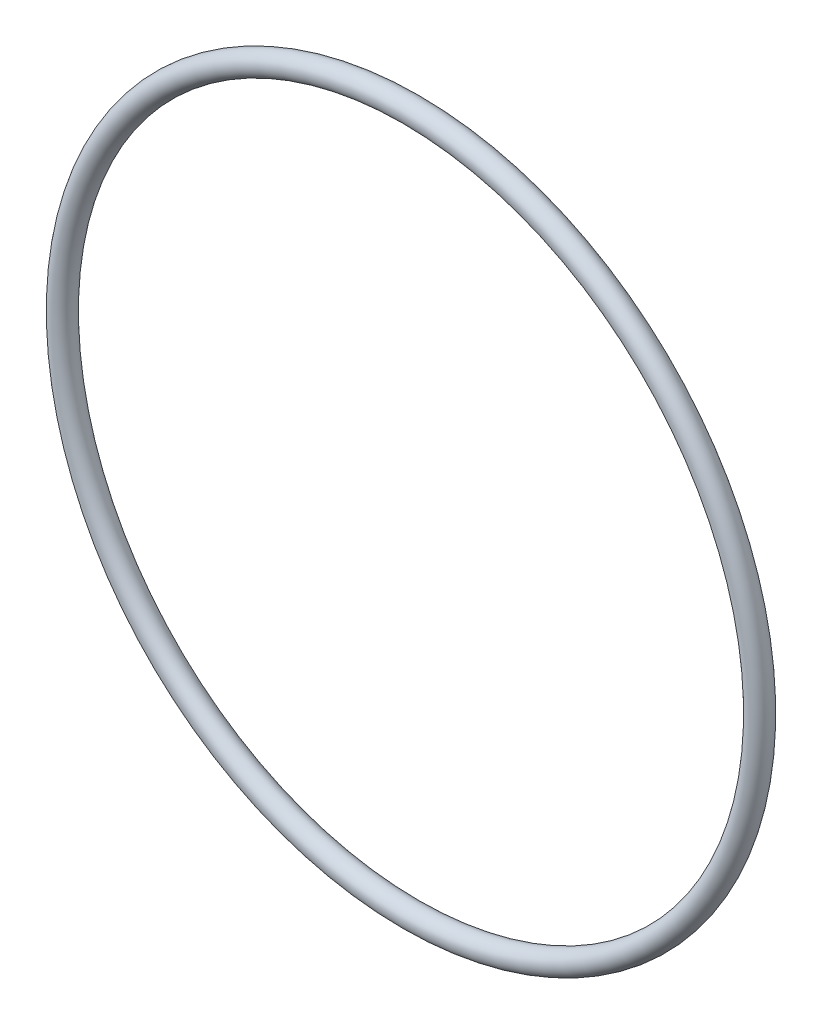
from build123d import *

# Parameters (mm, degrees)
SKETCH1_R = 0.75


with BuildPart() as part:
    # Sketch1 → Revolve1 (revolve)
    with BuildSketch(Plane(origin=(0, 0, 0), x_dir=(0, 0, -1), z_dir=(1, 0, 0))):
        with Locations((0, 23)):
            Circle(SKETCH1_R)
    revolve(axis=Axis((0, 0, 0), (0, 0, 1)))


solid = part.part
